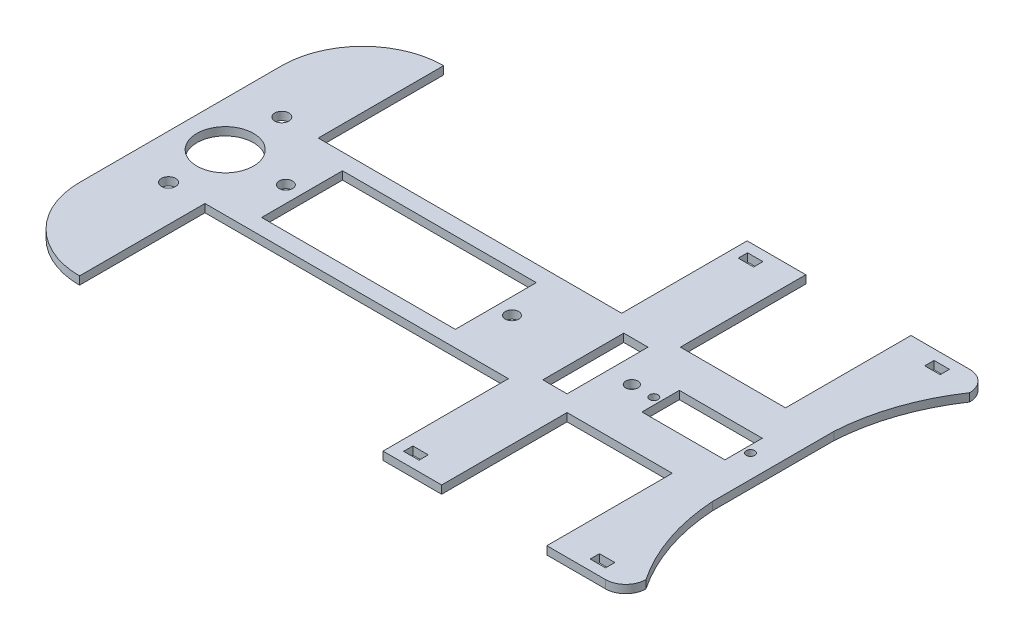
from build123d import *

# Parameters (mm, degrees)
CROQUIS1_R              = 1.75
CROQUIS1_R_2            = 1.05
CROQUIS1_R_3            = 1.65
CROQUIS1_R_4            = 7
CROQUIS1_R_5            = 1.5
CROQUIS1_W              = 20.5
CROQUIS1_H              = 9.25
CROQUIS1_W_2            = 3.8
CROQUIS1_H_2            = 2.3
CROQUIS1_W_3            = 6
CROQUIS1_H_3            = 20
CROQUIS1_W_4            = 47.88
SALIENTE_EXTRUIR1_DEPTH = 2


with BuildPart() as part:
    # Croquis1 → Saliente-Extruir1 (new body)
    with BuildSketch(Plane(origin=(0, 0, 0), x_dir=(1, 0, 0), z_dir=(0, 1, 0))):
        with BuildLine():
            Line((-49.462248263, 45), (-49.462248263, 14))
            Line((-49.462248263, 14), (25.537751737, 14))
            Line((25.537751737, 14), (25.537751737, 45))
            Line((25.537751737, 45), (40.037751737, 45))
            Line((40.037751737, 45), (40.037751737, 14))
            Line((40.037751737, 14), (66.037751737, 14))
            Line((66.037751737, 14), (66.037751737, 45))
            Line((66.037751737, 45), (80.537751737, 45))
            ThreePointArc((80.537751737, 45), (84.073285643, 43.535533906), (85.537751737, 40))
            ThreePointArc((85.537751737, 40), (79.612228902, 28.069677764), (77.037751737, 15))
            Line((77.037751737, 15), (77.037751737, -15))
            ThreePointArc((77.037751737, -15), (79.612228902, -28.069677764), (85.537751737, -40))
            ThreePointArc((85.537751737, -40), (84.073285643, -43.535533906), (80.537751737, -45))
            Line((80.537751737, -45), (66.037751737, -45))
            Line((66.037751737, -45), (66.037751737, -14))
            Line((66.037751737, -14), (40.037751737, -14))
            Line((40.037751737, -14), (40.037751737, -45))
            Line((40.037751737, -45), (25.537751737, -45))
            Line((25.537751737, -45), (25.537751737, -14))
            Line((25.537751737, -14), (-49.462248263, -14))
            Line((-49.462248263, -14), (-49.462248263, -45))
            ThreePointArc((-49.462248263, -45), (-63.604383887, -39.142135624), (-69.462248263, -25))
            Line((-69.462248263, -25), (-69.462248263, 25))
            ThreePointArc((-69.462248263, 25), (-63.604383887, 39.142135624), (-49.462248263, 45))
        make_face()
        with Locations(Location((-58.462248263, -14, 0), (0, 0, 270))):
            Circle(CROQUIS1_R, mode=Mode.SUBTRACT)
        with Locations(Location((-58.462248263, 14, 0), (0, 0, 90))):
            Circle(CROQUIS1_R, mode=Mode.SUBTRACT)
        with Locations(Location((71.365251737, 0, 0), (0, 0, 270))):
            Circle(CROQUIS1_R_2, mode=Mode.SUBTRACT)
        with Locations(Location((47.465251737, 0, 0), (0, 0, 270))):
            Circle(CROQUIS1_R_2, mode=Mode.SUBTRACT)
        with Locations(Location((-43.462248263, 0, 0), (0, 0, 270))):
            Circle(CROQUIS1_R_3, mode=Mode.SUBTRACT)
        with Locations(Location((12.417751737, 0, 0), (0, 0, 270))):
            Circle(CROQUIS1_R_3, mode=Mode.SUBTRACT)
        with Locations(Location((-58.462248263, 0, 0), (0, 0, 270))):
            Circle(CROQUIS1_R_4, mode=Mode.SUBTRACT)
        with Locations(Location((42.037751737, 0, 0), (0, 0, 270))):
            Circle(CROQUIS1_R_5, mode=Mode.SUBTRACT)
        with Locations((59.415251737, 0)):
            Rectangle(CROQUIS1_W, CROQUIS1_H, mode=Mode.SUBTRACT)
        with Locations((30.037751737, 41.35)):
            Rectangle(CROQUIS1_W_2, CROQUIS1_H_2, mode=Mode.SUBTRACT)
        with Locations((76.137751737, 41.35)):
            Rectangle(CROQUIS1_W_2, CROQUIS1_H_2, mode=Mode.SUBTRACT)
        with Locations((76.137751737, -41.35)):
            Rectangle(CROQUIS1_W_2, CROQUIS1_H_2, mode=Mode.SUBTRACT)
        with Locations((30.037751737, -41.35)):
            Rectangle(CROQUIS1_W_2, CROQUIS1_H_2, mode=Mode.SUBTRACT)
        with Locations((33.037751737, 0)):
            Rectangle(CROQUIS1_W_3, CROQUIS1_H_3, mode=Mode.SUBTRACT)
        with Locations((-15.522248263, 0)):
            Rectangle(CROQUIS1_W_4, CROQUIS1_H_3, mode=Mode.SUBTRACT)
    extrude(amount=SALIENTE_EXTRUIR1_DEPTH)


solid = part.part
